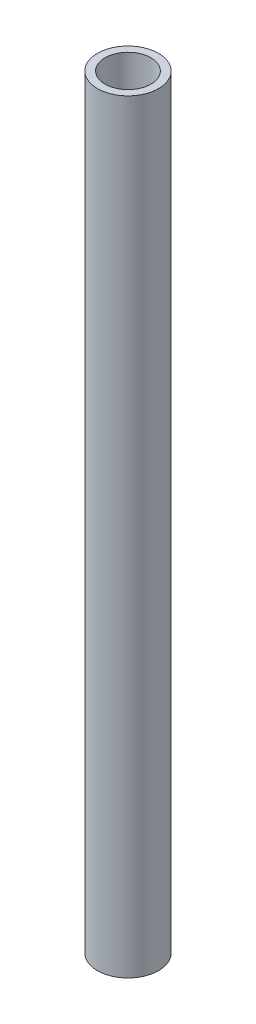
from build123d import *

# Parameters (mm, degrees)
SKETCH2_R   = 4
SKETCH2_R_2 = 3


with BuildPart() as part:
    # Sweep1: sweep along a path in Sketch1
    with BuildLine(Plane.XY) as sweep1_path:
        Line((0, 0), (0, 100))
    # Sketch2 → Sweep1 (sweep)
    with BuildSketch(Plane(origin=(0, 0, 0), x_dir=(1, 0, 0), z_dir=(0, 1, 0))):
        Circle(SKETCH2_R)
        Circle(SKETCH2_R_2, mode=Mode.SUBTRACT)
    sweep(path=sweep1_path.line)


solid = part.part
